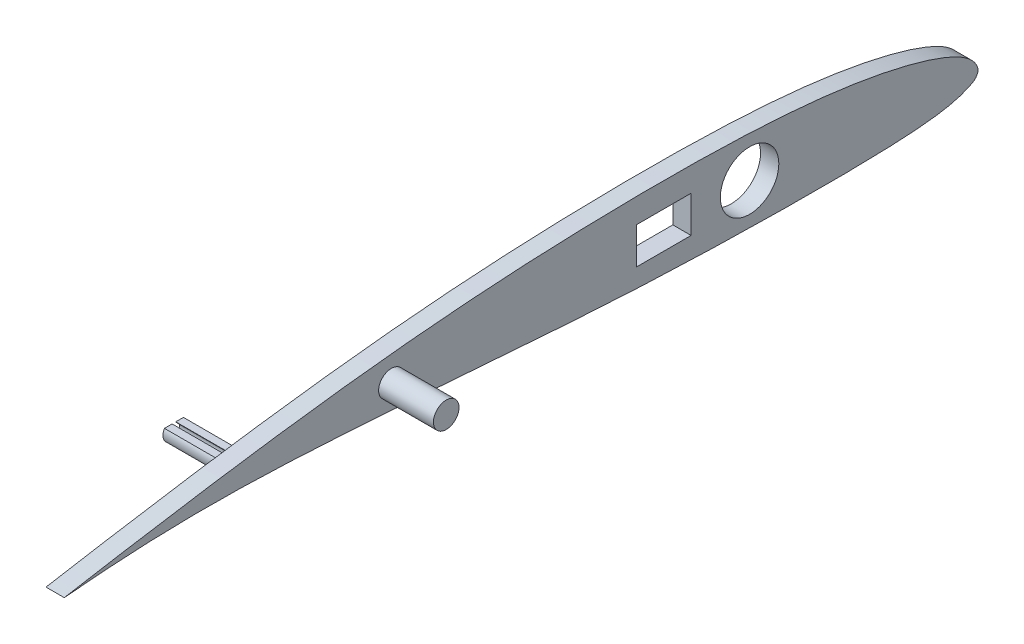
from build123d import *

# Parameters (mm, degrees)
SCHIZZO1_R                  = 8
SCHIZZO1_W                  = 15
SCHIZZO1_H                  = 10
CORPOFOAM_DEPTH             = 5
SCHIZZO2_R                  = 3.5
PERNOAGGANCIO_DEPTH         = 20
PERNOAGGANCIOALETTONE_DEPTH = 20


with BuildPart() as part:
    # Schizzo1 → CorpoFoam (new body)
    with BuildSketch(Plane(origin=(0, 0, 0), x_dir=(0, 0, -1), z_dir=(1, 0, 0))):
        with BuildLine():
            add(Edge.make_bspline(
                [(-250, 0), (-250.000228294, -0.008042796), (-248.284955516, 0.172375658), (-246.518112419, 0.308690015), (-242.189387343, 0.685693594), (-236.806461263, 1.074101529), (-229.680385952, 1.49731724), (-221.184158698, 1.823218603), (-211.337618208, 1.967626101), (-200.371188527, 1.833221056), (-188.499913622, 1.38960529), (-175.953687417, 0.706014078), (-162.931424918, -0.160208642), (-149.615771744, -1.148016327), (-136.176354995, -2.19092491), (-122.767140548, -3.219583979), (-109.520053587, -4.152743127), (-96.546095975, -4.938564365), (-83.940819302, -5.536830703), (-71.801839291, -5.947648205), (-60.245256003, -6.218450939), (-49.398732891, -6.355369756), (-39.397226194, -6.381387963), (-30.361934842, -6.26504923), (-22.412181103, -6.012164917), (-15.626227231, -5.597433901), (-10.071907511, -4.928706579), (-5.697692612, -4.040446981), (-2.625320639, -2.865752984), (-0.494884225, -1.71152847), (0.021312549, -0.410454231), (-0.0311692, 0.792659827), (-0.812599242, 2.305684337), (-2.728863517, 4.238352424), (-5.769907241, 6.118172121), (-9.880942804, 7.913594202), (-15.074930468, 9.641318178), (-21.298752222, 11.283896488), (-28.49717212, 12.788381759), (-36.607373406, 14.097834908), (-45.57302844, 15.159429017), (-55.332910074, 15.960903998), (-65.816536498, 16.494069738), (-76.93137626, 16.791989705), (-88.566949028, 16.864754131), (-100.596999886, 16.726715291), (-112.888825982, 16.383385064), (-125.311615819, 15.825573667), (-137.743791097, 15.05233187), (-150.072384382, 14.059339074), (-162.191375056, 12.881586986), (-173.989074322, 11.549280346), (-185.352364446, 10.116249729), (-196.163081698, 8.632379125), (-206.300441402, 7.131513884), (-215.560350587, 5.731221768), (-223.977157043, 4.293295127), (-231.363413336, 3.181808874), (-237.746440904, 2.098942417), (-242.622069366, 1.245861917), (-246.644529332, 0.552864946), (-248.32839844, 0.246216765), (-249.999773563, 0.007977377), (-250, 0)],
                knots=[0, 0, 0, 0, 0.001588889, 0.006329218, 0.014202456, 0.025172808, 0.039173483, 0.056060631, 0.075578924, 0.097363607, 0.120926258, 0.145825281, 0.171670912, 0.198108537, 0.224790184, 0.25139058, 0.277643491, 0.30332675, 0.328257458, 0.352272548, 0.375156062, 0.396620664, 0.416422729, 0.43430442, 0.45005468, 0.463465465, 0.474478994, 0.483169222, 0.489678354, 0.494104066, 0.496910015, 0.497289785, 0.501214273, 0.50645795, 0.513356957, 0.522168632, 0.53296597, 0.545689209, 0.560220779, 0.576438923, 0.594258689, 0.613600245, 0.634342386, 0.656331109, 0.679351894, 0.703152303, 0.727478208, 0.752070739, 0.776691164, 0.801140184, 0.825214387, 0.848697424, 0.871352858, 0.892947449, 0.913230871, 0.931955467, 0.948342069, 0.963693004, 0.976235918, 0.986320059, 0.993788799, 0.998424035, 1, 1, 1, 1], degree=3))
        make_face()
        with Locations((-62.499919709, 5.077322704)):
            Circle(SCHIZZO1_R, mode=Mode.SUBTRACT)
        with Locations((-85.999919709, 5.077322704)):
            Rectangle(SCHIZZO1_W, SCHIZZO1_H, mode=Mode.SUBTRACT)
    extrude(amount=CORPOFOAM_DEPTH)

    # Schizzo2 → PernoAggancio (add)
    with BuildSketch(Plane.ZY):
        with Locations((160.499919709, 6.077322704)):
            Circle(SCHIZZO2_R)
    extrude(amount=-PERNOAGGANCIO_DEPTH)

    # Schizzo3 → PernoAggancioAlettone (add)
    with BuildSketch(Plane(origin=(5, 0, 0), x_dir=(0, 0, -1), z_dir=(1, 0, 0))):
        with BuildLine():
            Line((-197.401923789, 6.41748059), (-199.5, 6.41748059))
            Line((-199.5, 6.41748059), (-199.5, 6.331694152))
            ThreePointArc((-199.5, 6.331694152), (-198.5, 4.91748059), (-199.5, 3.503267027))
            Line((-199.5, 3.503267027), (-199.5, 3.41748059))
            Line((-199.5, 3.41748059), (-197.401923789, 3.41748059))
            ThreePointArc((-197.401923789, 3.41748059), (-197, 4.91748059), (-197.401923789, 6.41748059))
        make_face()
        with BuildLine():
            Line((-200.5, 6.41748059), (-200.5, 6.331694152))
            ThreePointArc((-200.5, 6.331694152), (-201.5, 4.91748059), (-200.5, 3.503267027))
            Line((-200.5, 3.503267027), (-200.5, 3.41748059))
            Line((-200.5, 3.41748059), (-202.598076211, 3.41748059))
            ThreePointArc((-202.598076211, 3.41748059), (-203, 4.91748059), (-202.598076211, 6.41748059))
            Line((-202.598076211, 6.41748059), (-200.5, 6.41748059))
        make_face()
    extrude(amount=-PERNOAGGANCIOALETTONE_DEPTH)


solid = part.part
